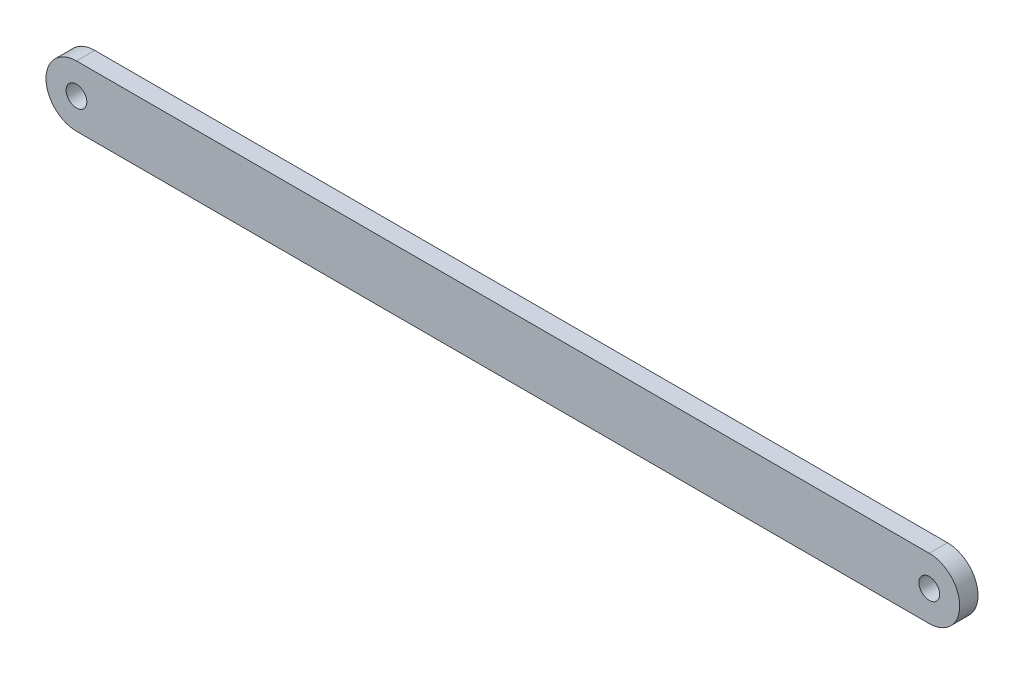
from build123d import *

# Parameters (mm, degrees)
AUFSATZ_LINEAR_AUSTRAGEN1_DEPTH = 1.5
DURCHGANGSLOCH_F_R_M31_D        = 3.4


with BuildPart() as part:
    # Skizze1 → Aufsatz-Linear austragen1 (new, symmetric)
    with BuildSketch(Plane.XY):
        with BuildLine():
            Line((-70, 5), (70, 5))
            ThreePointArc((70, 5), (75, 0), (70, -5))
            Line((70, -5), (-70, -5))
            ThreePointArc((-70, -5), (-75, 0), (-70, 5))
        make_face()
    extrude(amount=AUFSATZ_LINEAR_AUSTRAGEN1_DEPTH, both=True)

    # Durchgangsloch für M31 (through all)
    with Locations(Plane.XY.offset(1.5)):
        with Locations((-70, 0), (70, 0)):
            Hole(DURCHGANGSLOCH_F_R_M31_D / 2)


solid = part.part
